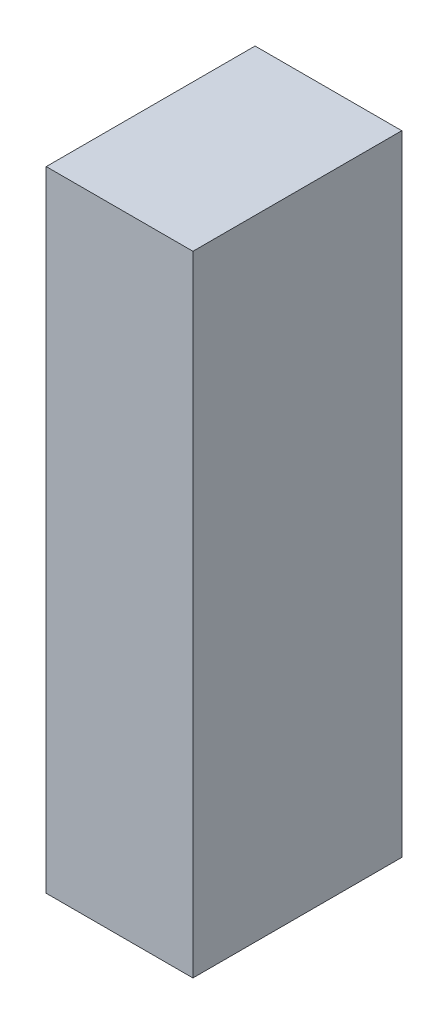
from build123d import *

# Parameters (mm, degrees)
ESQUISSE1_W      = 7.024060517
ESQUISSE1_H      = 30.135181644
EXTRUSION1_DEPTH = 10


with BuildPart() as part:
    # Esquisse1 → Extrusion1 (new body)
    with BuildSketch(Plane.XY):
        with Locations((3.512030259, 15.067590822)):
            Rectangle(ESQUISSE1_W, ESQUISSE1_H)
    extrude(amount=EXTRUSION1_DEPTH)


solid = part.part
